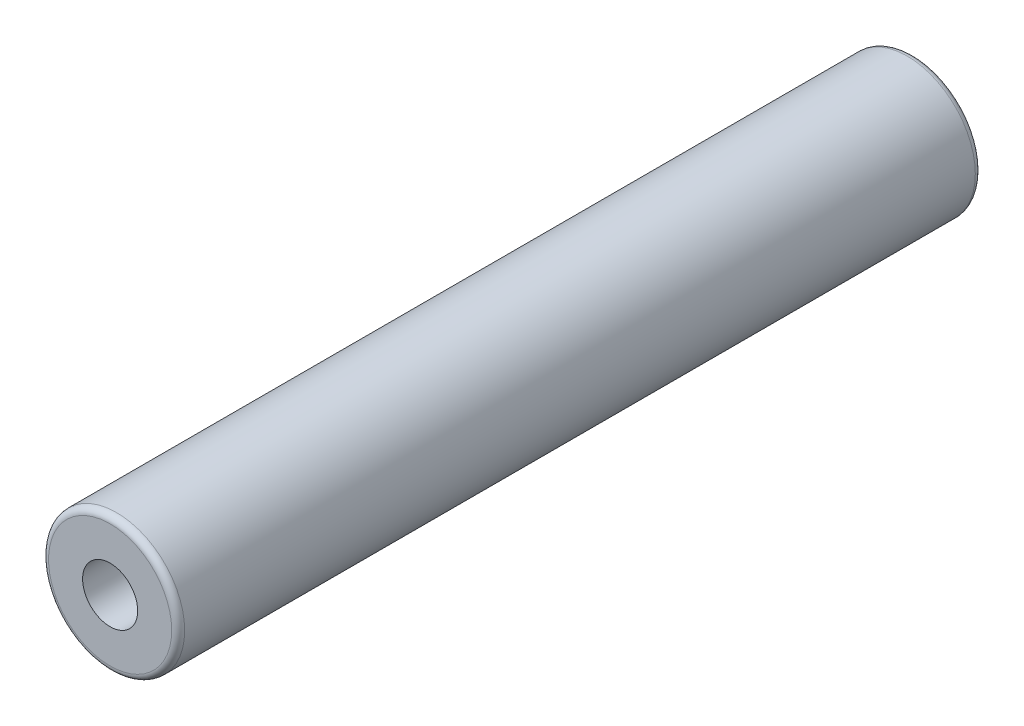
from build123d import *

# Parameters (mm, degrees)
ESBO_O1_R                                    = 10.5
RESSALTO_EXTRUS_O1_DEPTH                     = 124
FILETE1_R                                    = 1
BROCA_DE_ROSQUEAR_PARA_TARRAXA_DE_M101_D     = 8.5
BROCA_DE_ROSQUEAR_PARA_TARRAXA_DE_M101_DEPTH = 25
BROCA_DE_ROSQUEAR_PARA_TARRAXA_DE_M101_TIP   = 2.553657631
BROCA_DE_ROSQUEAR_PARA_TARRAXA_DE_M102_D     = 8.5
BROCA_DE_ROSQUEAR_PARA_TARRAXA_DE_M102_DEPTH = 25
BROCA_DE_ROSQUEAR_PARA_TARRAXA_DE_M102_TIP   = 2.553657631


with BuildPart() as part:
    # Esboço1 → Ressalto-extrusão1 (new body)
    with BuildSketch(Plane.XY):
        with Locations((-70, 54)):
            Circle(ESBO_O1_R)
    extrude(amount=-RESSALTO_EXTRUS_O1_DEPTH)

    # Filete1
    filete1_edges = [part.edges().sort_by_distance(p)[0] for p in [
        (-80.5, 54, 0),
        (-80.5, 54, -124),
    ]]
    fillet(filete1_edges, radius=FILETE1_R)

    # Broca de rosquear para tarraxa de M101
    with Locations(Plane.XY):
        with Locations((-70, 54)):
            Hole(BROCA_DE_ROSQUEAR_PARA_TARRAXA_DE_M101_D / 2, depth=BROCA_DE_ROSQUEAR_PARA_TARRAXA_DE_M101_DEPTH)
            with Locations((0, 0, -(BROCA_DE_ROSQUEAR_PARA_TARRAXA_DE_M101_DEPTH + BROCA_DE_ROSQUEAR_PARA_TARRAXA_DE_M101_TIP / 2))):  # 118° drill point
                Cone(0, BROCA_DE_ROSQUEAR_PARA_TARRAXA_DE_M101_D / 2, BROCA_DE_ROSQUEAR_PARA_TARRAXA_DE_M101_TIP, mode=Mode.SUBTRACT)

    # Broca de rosquear para tarraxa de M102
    with Locations(Plane(origin=(0, 0, -124), x_dir=(-1, 0, 0), z_dir=(0, 0, -1))):
        with Locations((70, 54)):
            Hole(BROCA_DE_ROSQUEAR_PARA_TARRAXA_DE_M102_D / 2, depth=BROCA_DE_ROSQUEAR_PARA_TARRAXA_DE_M102_DEPTH)
            with Locations((0, 0, -(BROCA_DE_ROSQUEAR_PARA_TARRAXA_DE_M102_DEPTH + BROCA_DE_ROSQUEAR_PARA_TARRAXA_DE_M102_TIP / 2))):  # 118° drill point
                Cone(0, BROCA_DE_ROSQUEAR_PARA_TARRAXA_DE_M102_D / 2, BROCA_DE_ROSQUEAR_PARA_TARRAXA_DE_M102_TIP, mode=Mode.SUBTRACT)


solid = part.part
